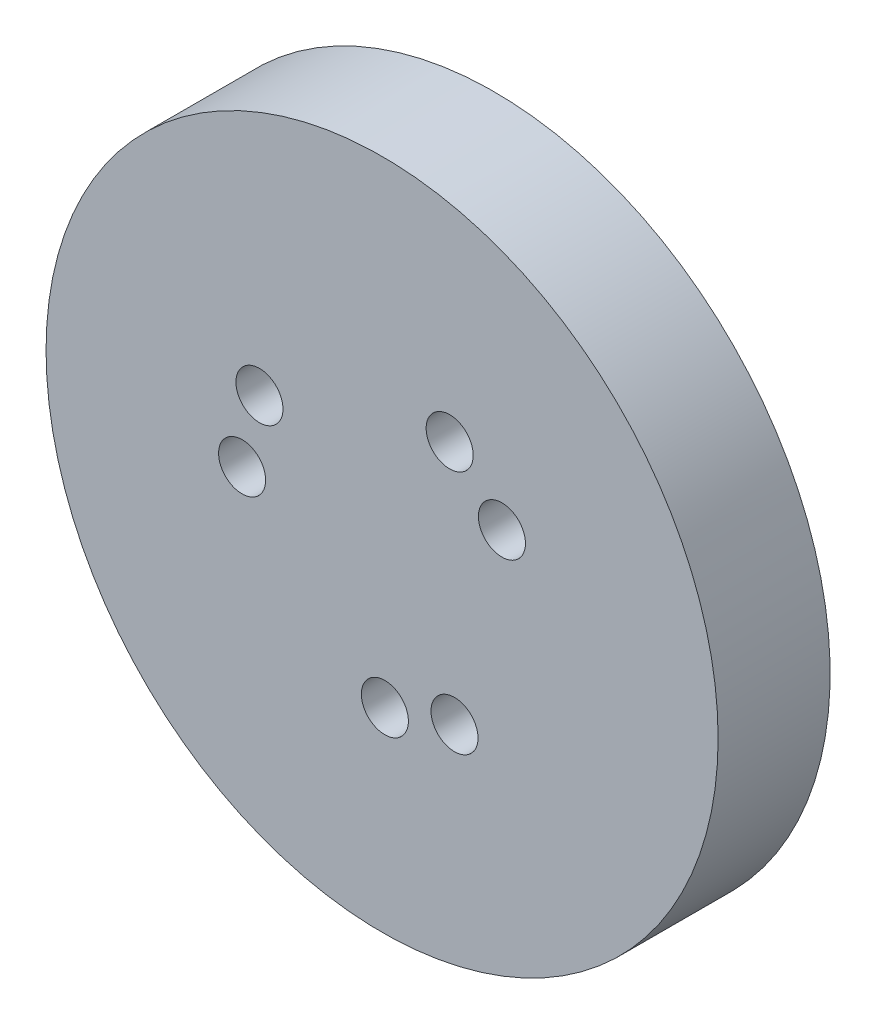
from build123d import *

# Parameters (mm, degrees)
SKETCH_2_R               = 15
SKETCH_2_R_2             = 10
EXTRUDE_2_DEPTH          = 4.6
CUT_EXTRUDE_8_DEPTH      = 20
CUT_EXTRUDE_8_DEPTH_BACK = 3.1
SKETCH_23_R              = 2.1
SKETCH_26_R              = 1.2
CUT_EXTRUDE_9_DEPTH      = 10
EXTRUDE_START            = -4.4
EXTRUDE_3_DEPTH          = 4.4
SKETCH_10_R              = 4
EXTRUDE_4_DEPTH          = 0.6
SKETCH_25_R              = 30
EXTRUDE_5_DEPTH          = 5
CUT_EXTRUDE_START        = 10
SKETCH_28_R              = 2.1
CUT_EXTRUDE_10_DEPTH     = 10
SKETCH_29_R              = 3.975
SKETCH_29_R_2            = 3.1
EXTRUDE_6_DEPTH          = 3.4
EXTRUDE_START_2          = 5
SKETCH_30_R              = 30
SKETCH_30_R_2            = 27
EXTRUDE_7_DEPTH          = 5


with BuildPart() as part:
    # 스케치2 → 보스-돌출2 (new body)
    with BuildSketch(Plane.XY):
        Circle(SKETCH_2_R)
        Circle(SKETCH_2_R_2, mode=Mode.SUBTRACT)
    extrude(amount=EXTRUDE_2_DEPTH)

    # 스케치23 → 컷-돌출8 (cut, two sides: drawn at the far end of the back side and taken through both)
    with BuildSketch(Plane.XY.offset(4.6).offset(-CUT_EXTRUDE_8_DEPTH_BACK)):
        with Locations((10.6986217, 6.464479385)):
            Circle(SKETCH_23_R)
        with Locations((6.033038485, 10.94771422)):
            Circle(SKETCH_23_R)
        with Locations((6.464479385, -10.6986217)):
            Circle(SKETCH_23_R)
        with Locations((0.249092519, -12.49751787)):
            Circle(SKETCH_23_R)
        with Locations((-12.49751787, -0.249092519)):
            Circle(SKETCH_23_R)
        with Locations((-10.94771422, 6.033038485)):
            Circle(SKETCH_23_R)
    extrude(amount=CUT_EXTRUDE_8_DEPTH + CUT_EXTRUDE_8_DEPTH_BACK, mode=Mode.SUBTRACT)

    # 스케치26 → 컷-돌출9 (cut)
    with BuildSketch(Plane.XY.offset(1.5)):
        with Locations((6.033038485, 10.94771422)):
            Circle(SKETCH_26_R)
        with Locations((10.6986217, 6.464479385)):
            Circle(SKETCH_26_R)
        with Locations((6.464479385, -10.6986217)):
            Circle(SKETCH_26_R)
        with Locations((0.249092519, -12.49751787)):
            Circle(SKETCH_26_R)
        with Locations((-10.94771422, 6.033038485)):
            Circle(SKETCH_26_R)
        with Locations((-12.49751787, -0.249092519)):
            Circle(SKETCH_26_R)
    extrude(amount=-CUT_EXTRUDE_9_DEPTH, mode=Mode.SUBTRACT)

    # 스케치8 → 보스-돌출3 (add)
    with BuildSketch(Plane.XY.offset(4.6).offset(EXTRUDE_START)):
        with BuildLine():
            ThreePointArc((-2.125, 3.680607966), (-3.993693638, 1.453585609), (-3.993693638, -1.453585609))
            add(Edge.make_bspline(
                [(-9.396926208, -3.420201433), (-9.732062183, -2.149175506), (-9.806172611, -0.835010365), (-9.456725912, 1.676046677), (-9.033681598, 2.871966971), (-7.789656699, 4.972884513), (-6.969506065, 5.877213907), (-5.085556702, 7.278578571), (-4.022753032, 7.775339442), (-1.834341922, 8.316896689), (-0.709724019, 8.361833006), (1.425354593, 8.02880188), (2.434991624, 7.65134079), (4.194832357, 6.566362619), (4.944502403, 5.859612911), (6.091617732, 4.253128009), (6.488888652, 3.354278704), (6.901731194, 1.519508339), (6.917493401, 0.584437672), (6.600877847, -1.174662508), (6.268999982, -1.998016278), (5.34306854, -3.416780201), (4.749719757, -4.011790899), (3.420699316, -4.904656893), (2.685804375, -5.202437862), (1.204674755, -5.486565699), (0.459151326, -5.473153796), (-0.923970423, -5.172953815), (-1.561040931, -4.886659174), (-2.638728045, -4.11977446), (-3.079079395, -3.639826603), (-3.717696054, -2.588270623), (-3.915987072, -2.017330047), (-3.993693638, -1.453585609)],
                knots=[0, 0, 0, 0, 0.0625, 0.0625, 0.125, 0.125, 0.1875, 0.1875, 0.25, 0.25, 0.3125, 0.3125, 0.375, 0.375, 0.4375, 0.4375, 0.5, 0.5, 0.5625, 0.5625, 0.625, 0.625, 0.6875, 0.6875, 0.75, 0.75, 0.8125, 0.8125, 0.875, 0.875, 0.9375, 0.9375, 1, 1, 1, 1], degree=3))
            ThreePointArc((-9.396926208, -3.420201433), (-3.420201433, -9.396926208), (5, -8.660254038))
            add(Edge.make_bspline(
                [(5, -8.660254038), (3.806479564, -9.211009881), (2.525148685, -9.512196786), (-0.008440541, -9.604099447), (-1.259652992, -9.395151506), (-3.544675532, -8.534846644), (-4.577683795, -7.884191092), (-6.284902954, -6.272207574), (-6.958670832, -5.311811899), (-7.872014208, -3.250688101), (-8.111555691, -2.150958779), (-8.154336566, 0.009513438), (-7.957931589, 1.069357245), (-7.195029811, 2.990866525), (-6.629196056, 3.851873198), (-5.246311756, 5.260524443), (-4.430103363, 5.807843469), (-2.694896637, 6.533018535), (-1.776768874, 6.710914596), (0.010586336, 6.704573685), (0.879061498, 6.520711671), (2.437057517, 5.855212978), (3.126062601, 5.37420102), (4.236145931, 4.220415939), (4.657016106, 3.548394826), (5.194022862, 2.139105174), (5.310273501, 1.402578969), (5.254810803, -0.011659233), (5.083491754, -0.688765751), (4.515396145, -1.883248509), (4.119205984, -2.400252004), (3.194520122, -3.21176742), (2.666686289, -3.506188743), (2.125, -3.680607966)],
                knots=[0, 0, 0, 0, 0.0625, 0.0625, 0.125, 0.125, 0.1875, 0.1875, 0.25, 0.25, 0.3125, 0.3125, 0.375, 0.375, 0.4375, 0.4375, 0.5, 0.5, 0.5625, 0.5625, 0.625, 0.625, 0.6875, 0.6875, 0.75, 0.75, 0.8125, 0.8125, 0.875, 0.875, 0.9375, 0.9375, 1, 1, 1, 1], degree=3))
            ThreePointArc((2.125, -3.680607966), (3.993693638, -1.453585609), (3.993693638, 1.453585609))
            add(Edge.make_bspline(
                [(9.396926208, 3.420201433), (9.732062183, 2.149175506), (9.806172611, 0.835010365), (9.456725912, -1.676046677), (9.033681598, -2.871966971), (7.789656699, -4.972884513), (6.969506065, -5.877213907), (5.085556702, -7.278578571), (4.022753032, -7.775339442), (1.834341922, -8.316896689), (0.709724019, -8.361833006), (-1.425354593, -8.02880188), (-2.434991624, -7.65134079), (-4.194832357, -6.566362619), (-4.944502403, -5.859612911), (-6.091617732, -4.253128009), (-6.488888652, -3.354278704), (-6.901731194, -1.519508339), (-6.917493401, -0.584437672), (-6.600877847, 1.174662508), (-6.268999982, 1.998016278), (-5.34306854, 3.416780201), (-4.749719757, 4.011790899), (-3.420699316, 4.904656893), (-2.685804375, 5.202437862), (-1.204674755, 5.486565699), (-0.459151326, 5.473153796), (0.923970423, 5.172953815), (1.561040931, 4.886659174), (2.638728045, 4.11977446), (3.079079395, 3.639826603), (3.717696054, 2.588270623), (3.915987072, 2.017330047), (3.993693638, 1.453585609)],
                knots=[0, 0, 0, 0, 0.0625, 0.0625, 0.125, 0.125, 0.1875, 0.1875, 0.25, 0.25, 0.3125, 0.3125, 0.375, 0.375, 0.4375, 0.4375, 0.5, 0.5, 0.5625, 0.5625, 0.625, 0.625, 0.6875, 0.6875, 0.75, 0.75, 0.8125, 0.8125, 0.875, 0.875, 0.9375, 0.9375, 1, 1, 1, 1], degree=3))
            ThreePointArc((9.396926208, 3.420201433), (3.420201433, 9.396926208), (-5, 8.660254038))
            add(Edge.make_bspline(
                [(-5, 8.660254038), (-3.806479564, 9.211009881), (-2.525148685, 9.512196786), (0.008440541, 9.604099447), (1.259652992, 9.395151506), (3.544675532, 8.534846644), (4.577683795, 7.884191092), (6.284902954, 6.272207574), (6.958670832, 5.311811899), (7.872014208, 3.250688101), (8.111555691, 2.150958779), (8.154336566, -0.009513438), (7.957931589, -1.069357245), (7.195029811, -2.990866525), (6.629196056, -3.851873198), (5.246311756, -5.260524443), (4.430103363, -5.807843469), (2.694896637, -6.533018535), (1.776768874, -6.710914596), (-0.010586336, -6.704573685), (-0.879061498, -6.520711671), (-2.437057517, -5.855212978), (-3.126062601, -5.37420102), (-4.236145931, -4.220415939), (-4.657016106, -3.548394826), (-5.194022862, -2.139105174), (-5.310273501, -1.402578969), (-5.254810803, 0.011659233), (-5.083491754, 0.688765751), (-4.515396145, 1.883248509), (-4.119205984, 2.400252004), (-3.194520122, 3.21176742), (-2.666686289, 3.506188743), (-2.125, 3.680607966)],
                knots=[0, 0, 0, 0, 0.0625, 0.0625, 0.125, 0.125, 0.1875, 0.1875, 0.25, 0.25, 0.3125, 0.3125, 0.375, 0.375, 0.4375, 0.4375, 0.5, 0.5, 0.5625, 0.5625, 0.625, 0.625, 0.6875, 0.6875, 0.75, 0.75, 0.8125, 0.8125, 0.875, 0.875, 0.9375, 0.9375, 1, 1, 1, 1], degree=3))
        make_face()
    extrude(amount=EXTRUDE_3_DEPTH)

    # 스케치10 → 보스-돌출4 (add)
    with BuildSketch(Plane.XY.offset(4.6)):
        Circle(SKETCH_10_R)
    extrude(amount=EXTRUDE_4_DEPTH)

    # 스케치25 → 보스-돌출5 (add)
    with BuildSketch(Plane.XY.offset(5.2)):
        Circle(SKETCH_25_R)
    extrude(amount=EXTRUDE_5_DEPTH)

    # 스케치28 → 컷-돌출10 (cut)
    with BuildSketch(Plane.XY.offset(4.6).offset(CUT_EXTRUDE_START)):
        with Locations((10.6986217, 6.464479385)):
            Circle(SKETCH_28_R)
        with Locations((6.033038485, 10.94771422)):
            Circle(SKETCH_28_R)
        with Locations((6.464479385, -10.6986217)):
            Circle(SKETCH_28_R)
        with Locations((0.249092519, -12.49751787)):
            Circle(SKETCH_28_R)
        with Locations((-12.49751787, -0.249092519)):
            Circle(SKETCH_28_R)
        with Locations((-10.94771422, 6.033038485)):
            Circle(SKETCH_28_R)
    extrude(amount=-CUT_EXTRUDE_10_DEPTH, mode=Mode.SUBTRACT)

    # 스케치30 → 보스-돌출7 (add)
    with BuildSketch(Plane(origin=(0, 0, 5.2), x_dir=(-1, 0, 0), z_dir=(0, 0, -1)).offset(EXTRUDE_START_2)):
        Circle(SKETCH_30_R)
        Circle(SKETCH_30_R_2, mode=Mode.SUBTRACT)
    extrude(amount=-EXTRUDE_7_DEPTH)


with BuildPart() as body_2:
    # 스케치29 → 보스-돌출6 (new body)
    with BuildSketch(Plane(origin=(0, 0, 0), x_dir=(-1, 0, 0), z_dir=(0, 0, -1))):
        Circle(SKETCH_29_R)
        Circle(SKETCH_29_R_2, mode=Mode.SUBTRACT)
    extrude(amount=EXTRUDE_6_DEPTH)


solid = Compound([part.part, body_2.part])
